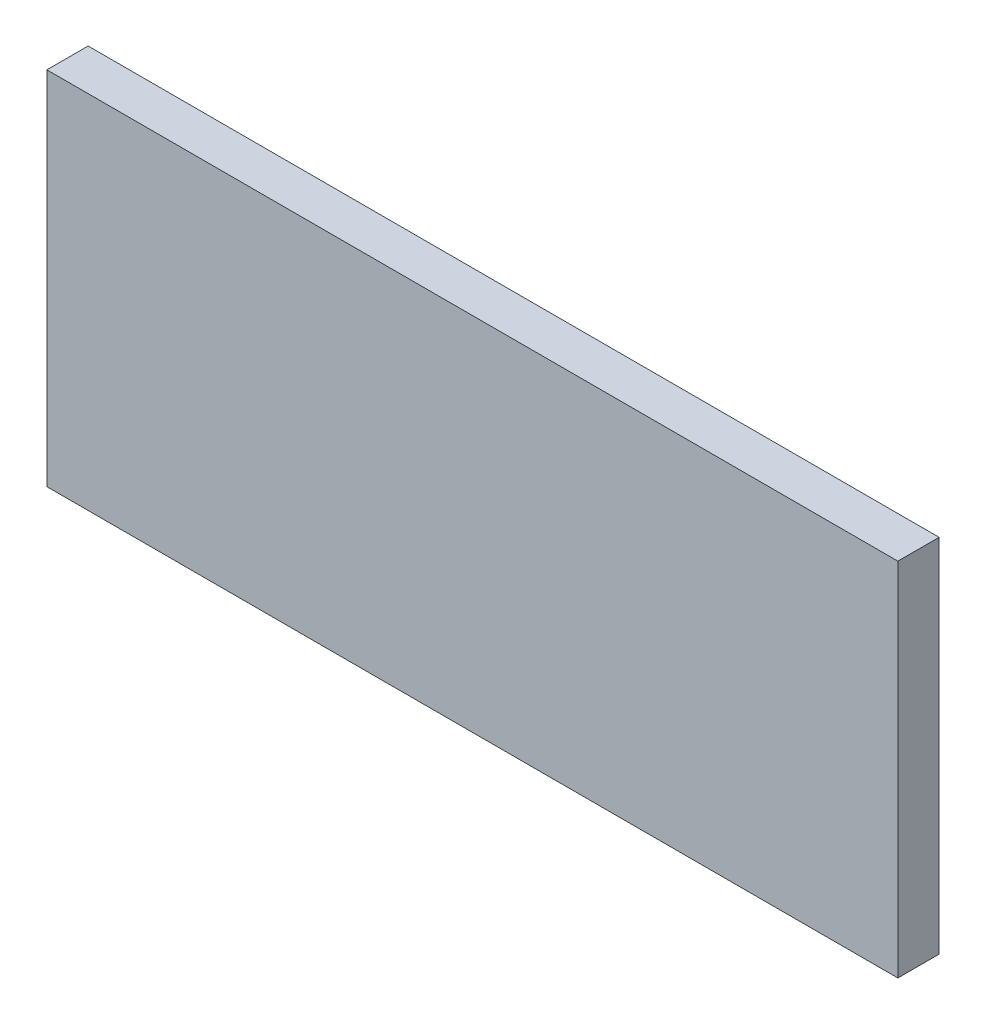
from build123d import *

# Parameters (mm, degrees)
SKETCH_1_W      = 330
SKETCH_1_H      = 140
EXTRUDE_1_DEPTH = 16


with BuildPart() as part:
    # 草图1 → 凸台-拉伸1 (new body)
    with BuildSketch(Plane.XY):
        Rectangle(SKETCH_1_W, SKETCH_1_H)
    extrude(amount=EXTRUDE_1_DEPTH)


solid = part.part
